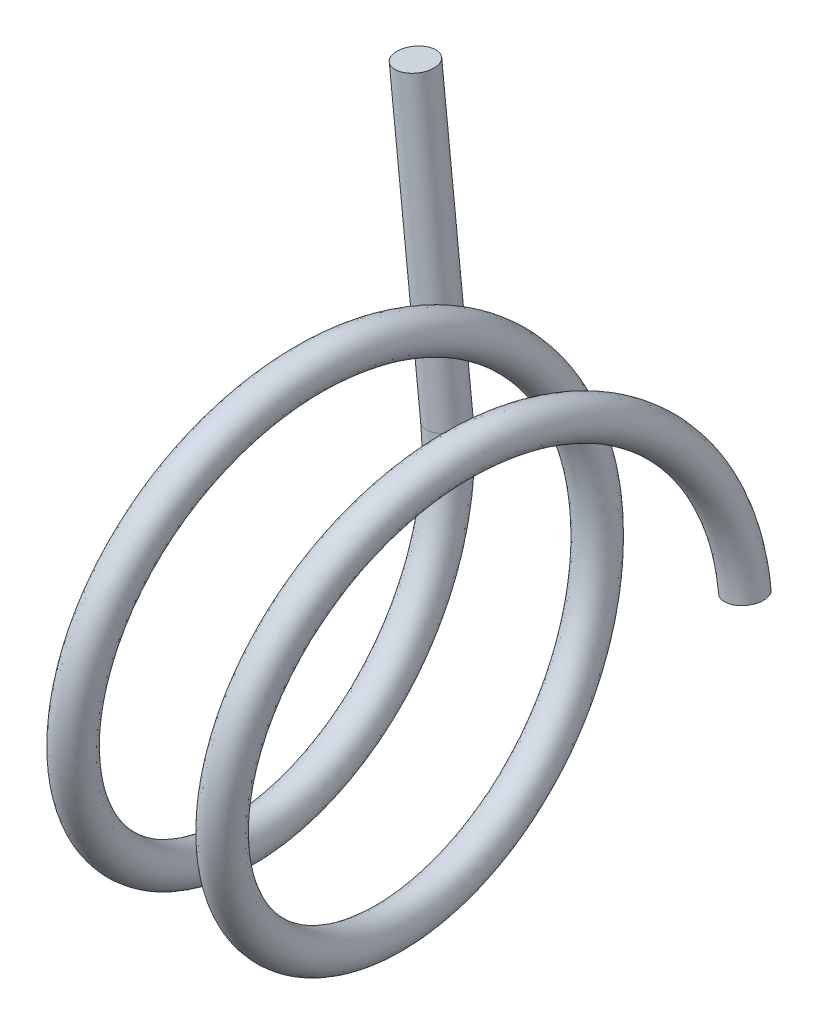
from build123d import *

# Parameters (mm, degrees)
SWEEP1_PITCH        = 25.4
SWEEP1_HEIGHT       = 50.8
SWEEP1_RADIUS       = 38.1
SWEEP1_START_ANGLE  = 180
SWEEP1_PROFILE_R    = 3.175
SKETCH11_R          = 3.175
BOSS_EXTRUDE1_DEPTH = 50.8


with BuildPart() as part:
    # Sweep1: sweep along a helix
    with BuildLine() as sweep1_path:
        add(Helix(SWEEP1_PITCH, SWEEP1_HEIGHT, SWEEP1_RADIUS, center=(0, 0, 0), direction=(1, 0, 0), lefthand=True, mode=Mode.PRIVATE).rotate(Axis((0, 0, 0), (1, 0, 0)), SWEEP1_START_ANGLE))
    # Sweep1 profile (on start of the path) → Sweep1 (sweep)
    with BuildSketch(Plane(origin=(0, 0, -38.1), x_dir=(-0.994418131511646, -0.10551104075349951, 0), z_dir=(0.10551104075349951, -0.994418131511646, 4.5442880229577413e-13))):
        Circle(SWEEP1_PROFILE_R)
    sweep(path=sweep1_path.line, is_frenet=True)

    # Sketch11 → Boss-Extrude1 (add)
    with BuildSketch(Plane(origin=(0, 0, 0), x_dir=(0.9944181315116436, 0.1055110407535228, 0), z_dir=(-0.10551104075352281, 0.9944181315116437, 0))):
        with Locations((0, 38.1)):
            Circle(SKETCH11_R)
    extrude(amount=BOSS_EXTRUDE1_DEPTH)


solid = part.part
